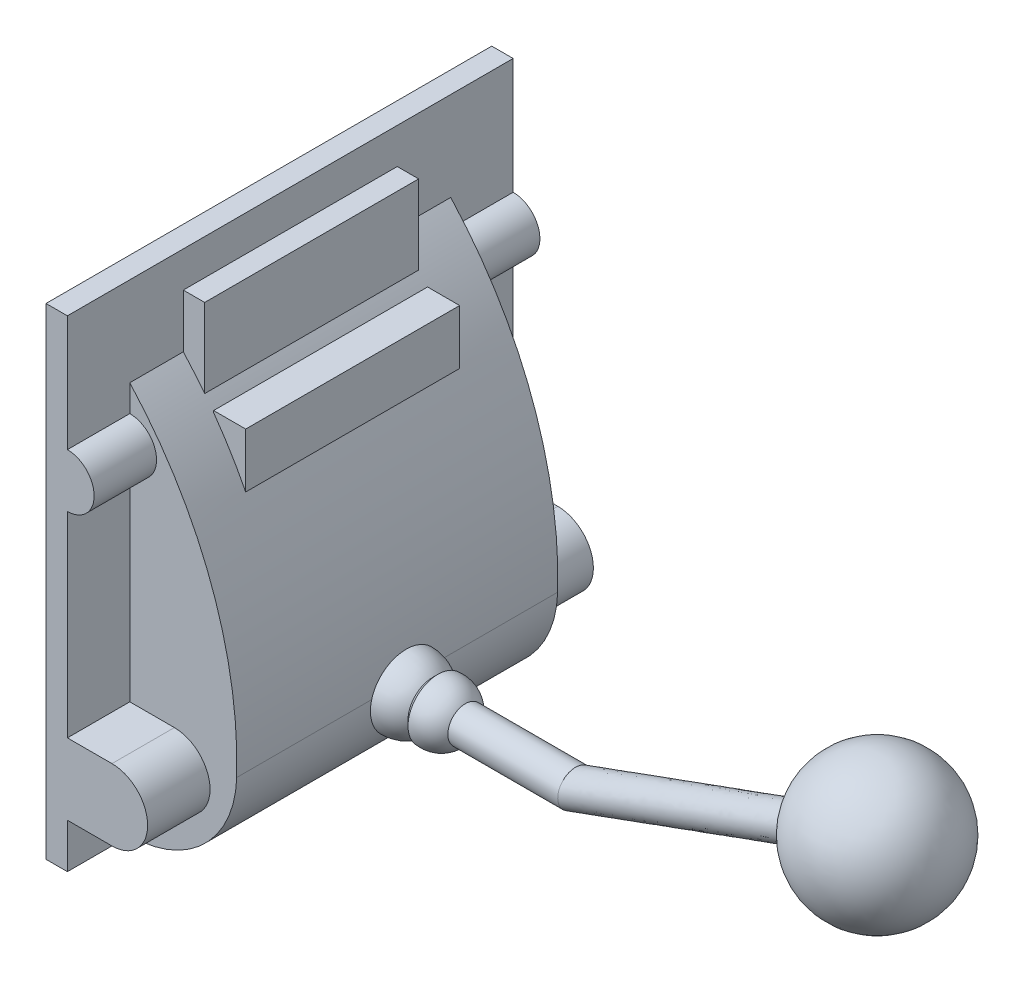
from build123d import *

# Parameters (mm, degrees)
BOSS_EXTRUDE2_DEPTH = 90
BOSS_EXTRUDE3_DEPTH = 12
SKETCH3_W           = 18
SKETCH3_H           = 76.981608939
SKETCH3_W_2         = 12
SKETCH3_H_2         = 76.255384777
BOSS_EXTRUDE4_DEPTH = 60
BOSS_EXTRUDE5_START = -250
BOSS_EXTRUDE5_DEPTH = 250
SKETCH5_R           = 10
BOSS_EXTRUDE6_DEPTH = 160
SKETCH8_R           = 10


with BuildPart() as part:
    # Sketch1 → Boss-Extrude2 (new, symmetric)
    with BuildSketch(Plane.XY):
        with BuildLine():
            Line((0, 0), (0, 220))
            ThreePointArc((0, 220), (45.729180399, 144.95403091), (59.974042828, 58.235294118))
            ThreePointArc((59.974042828, 58.235294118), (41.797832761, 16.954196761), (0, 0))
        make_face()
    extrude(amount=BOSS_EXTRUDE2_DEPTH, both=True)

    # Sketch2 → Boss-Extrude3 (add)
    with BuildSketch(Plane.ZY):
        Polygon((0, 0), (125, 0), (125, 270), (-125, 270), (-125, 0), align=None)
    extrude(amount=BOSS_EXTRUDE3_DEPTH)

    # Sketch3 → Boss-Extrude4 (add, symmetric)
    with BuildSketch(Plane.XY):
        with Locations((26, 161.50919553)):
            Rectangle(SKETCH3_W, SKETCH3_H)
        with Locations((6, 211.872307612)):
            Rectangle(SKETCH3_W_2, SKETCH3_H_2)
    extrude(amount=BOSS_EXTRUDE4_DEPTH, both=True)

    # Sketch4 → Boss-Extrude5 (add)
    with BuildSketch(Plane.XY.offset(125).offset(BOSS_EXTRUDE5_START)):
        with BuildLine():
            Line((0, 65), (25, 65))
            ThreePointArc((25, 65), (45, 45), (25, 25))
            Line((25, 25), (0, 25))
            Line((0, 25), (0, 65))
        make_face()
        with BuildLine():
            Line((0, 205), (0, 175))
            ThreePointArc((0, 175), (15, 190), (0, 205))
        make_face()
    extrude(amount=BOSS_EXTRUDE5_DEPTH)

    # Sketch5 → Boss-Extrude6 (add)
    with BuildSketch(Plane(origin=(0, 0, 0), x_dir=(0, 0, -1), z_dir=(1, 0, 0))):
        with Locations((0, 58.235294118)):
            Circle(SKETCH5_R)
    extrude(amount=BOSS_EXTRUDE6_DEPTH)

    # Sketch6 → Revolve2 (revolve)
    with BuildSketch(Plane(origin=(0, 58, 0), x_dir=(1, 0, 0), z_dir=(0, 1, 0))):
        with BuildLine():
            Line((81.674631605, 0), (101.674631605, 0))
            ThreePointArc((101.674631605, 0), (96.000878794, 12.625507314), (82.792800006, 16.765744099))
            Line((82.792800006, 16.765744099), (79.883742711, 13.856686803))
            ThreePointArc((79.883742711, 13.856686803), (73.043114259, 18.427448605), (64.974042828, 20.032486705))
            Line((64.974042828, 20.032486705), (64.974042828, 0))
            Line((64.974042828, 0), (81.674631605, 0))
        make_face()
    revolve(axis=Axis((64.974042828, 58, 0), (1, 0, 0)))

    # Sweep1: sweep along a path in Sketch7
    with BuildLine(Plane.XY) as sweep1_path:
        Line((160, 58.235294118), (329.144671741, 119.798919916))
    # Sketch8 → Sweep1 (sweep)
    with BuildSketch(Plane(origin=(160, 0, 0), x_dir=(0, 0, -1), z_dir=(1, 0, 0))):
        with Locations((0, 58.235294118)):
            Circle(SKETCH8_R)
    sweep(path=sweep1_path.line)

    # Sketch9 → Revolve3 (revolve)
    with BuildSketch(Plane.XY):
        with BuildLine():
            Line((329.144671741, 119.798919916), (329.144671741, 79.798919916))
            ThreePointArc((329.144671741, 79.798919916), (369.144671741, 119.798919916), (329.144671741, 159.798919916))
            Line((329.144671741, 159.798919916), (329.144671741, 119.798919916))
        make_face()
    revolve(axis=Axis((329.144671741, 119.798919916, 0), (0, -1, 0)))


solid = part.part
